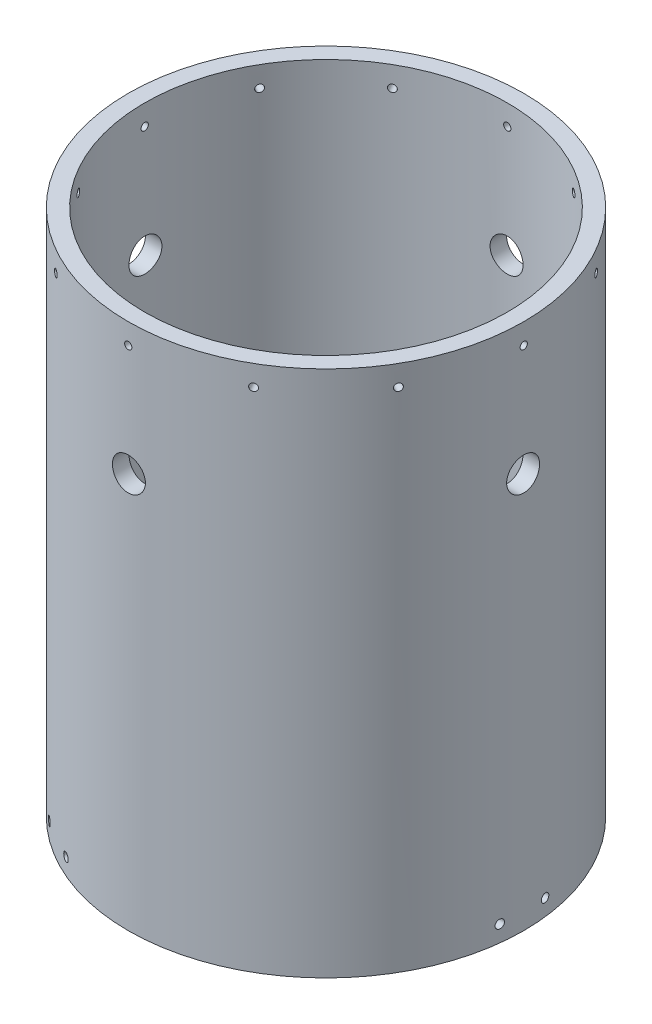
from build123d import *

# Parameters (mm, degrees)
SKETCH1_R                         = 152.4
SKETCH1_R_2                       = 139.7
BOSS_EXTRUDE1_DEPTH               = 406.4
F_10_CLEARANCE_HOLE1_REACH        = 532.368
F_10_CLEARANCE_HOLE1_BORE_R       = 2.8067
CIRPATTERN1_COUNT                 = 12
CUT_EXTRUDE1_REACH                = 532.368
CUT_EXTRUDE1_END_RADIUS           = 139.7
SKETCH4_R                         = 12.7
CIRPATTERN2_COUNT                 = 4
TAP_DRILL_FOR_5_16_18_TAP1_REACH  = 532.368
TAP_DRILL_FOR_5_16_18_TAP1_BORE_R = 3.2639
CIRPATTERN3_COUNT                 = 3


with BuildPart() as part:
    # Sketch1 → Boss-Extrude1 (new body)
    with BuildSketch(Plane(origin=(0, 0, 0), x_dir=(1, 0, 0), z_dir=(0, 1, 0))):
        with Locations(Location((0, 0, 0), (0, 0, 270))):
            Circle(SKETCH1_R)
        with Locations(Location((0, 0, 0), (0, 0, 270))):
            Circle(SKETCH1_R_2, mode=Mode.SUBTRACT)
    extrude(amount=BOSS_EXTRUDE1_DEPTH)

    # #10 Clearance Hole1 bore → #10 Clearance Hole1 (cut, up to next)
    with BuildSketch(Plane(origin=(152.4, 0, 0), x_dir=(0, 0, -1), z_dir=(1, 0, 0)), mode=Mode.PRIVATE) as f_10_clearance_hole1_sk1:
        with Locations((0, 390.525)):
            Circle(F_10_CLEARANCE_HOLE1_BORE_R)
    f_10_clearance_hole1_tool1 = extrude(f_10_clearance_hole1_sk1.sketch, amount=-F_10_CLEARANCE_HOLE1_REACH, mode=Mode.PRIVATE) & part.part
    f_10_clearance_hole1 = f_10_clearance_hole1_tool1.solids().sort_by_distance((152.4, 390.525, 0))[0]
    add(f_10_clearance_hole1, mode=Mode.SUBTRACT)

    # CirPattern1: #10 Clearance Hole1 ×12 about axis
    cirpattern1_axis = Axis((0, 406.4, 0), (0, 1, 0))
    for i in range(1, CIRPATTERN1_COUNT):
        add(f_10_clearance_hole1.rotate(cirpattern1_axis, i * 360 / CIRPATTERN1_COUNT), mode=Mode.SUBTRACT)

    # Cut-Extrude1: up to this cylinder (the profile starts outside it)
    cut_extrude1_end = Plane(origin=(0, 304.8, 0), z_dir=(0, -1, 0)) * Cylinder(CUT_EXTRUDE1_END_RADIUS, 1345.136, mode=Mode.PRIVATE)
    # Sketch4 → Cut-Extrude1 (cut, up to the surface)
    with BuildSketch(Plane(origin=(152.4, 0, 0), x_dir=(0, 0, -1), z_dir=(1, 0, 0)), mode=Mode.PRIVATE) as cut_extrude1_sk1:
        with Locations((0, 304.8)):
            Circle(SKETCH4_R)
    cut_extrude1_tool1 = extrude(cut_extrude1_sk1.sketch, amount=-CUT_EXTRUDE1_REACH, mode=Mode.PRIVATE) - cut_extrude1_end
    cut_extrude1 = cut_extrude1_tool1.solids().sort_by_distance((152.4, 304.8, 0))[0]
    add(cut_extrude1, mode=Mode.SUBTRACT)

    # CirPattern2: Cut-Extrude1 ×4 about axis
    cirpattern2_axis = Axis((0, 406.4, 0), (0, -1, 0))
    for i in range(1, CIRPATTERN2_COUNT):
        add(cut_extrude1.rotate(cirpattern2_axis, i * 360 / CIRPATTERN2_COUNT), mode=Mode.SUBTRACT)

    # Tap Drill for 5/16-18 Tap1 bore → Tap Drill for 5/16-18 Tap1 (cut, up to next)
    with BuildSketch(Plane(origin=(152.4, 0, 0), x_dir=(0, 0, -1), z_dir=(1, 0, 0)), mode=Mode.PRIVATE) as tap_drill_for_5_16_18_tap1_sk1:
        with Locations((17.4625, 12.7)):
            Circle(TAP_DRILL_FOR_5_16_18_TAP1_BORE_R)
    tap_drill_for_5_16_18_tap1_tool1 = extrude(tap_drill_for_5_16_18_tap1_sk1.sketch, amount=-TAP_DRILL_FOR_5_16_18_TAP1_REACH, mode=Mode.PRIVATE) & part.part
    # Tap Drill for 5/16-18 Tap1 bore → Tap Drill for 5/16-18 Tap1 (cut, up to next)
    with BuildSketch(Plane(origin=(152.4, 0, 0), x_dir=(0, 0, -1), z_dir=(1, 0, 0)), mode=Mode.PRIVATE) as tap_drill_for_5_16_18_tap1_sk2:
        with Locations((-17.4625, 12.7)):
            Circle(TAP_DRILL_FOR_5_16_18_TAP1_BORE_R)
    tap_drill_for_5_16_18_tap1_tool2 = extrude(tap_drill_for_5_16_18_tap1_sk2.sketch, amount=-TAP_DRILL_FOR_5_16_18_TAP1_REACH, mode=Mode.PRIVATE) & part.part
    tap_drill_for_5_16_18_tap1_1 = tap_drill_for_5_16_18_tap1_tool1.solids().sort_by_distance((152.4, 12.7, -17.4625))[0]
    add(tap_drill_for_5_16_18_tap1_1, mode=Mode.SUBTRACT)
    tap_drill_for_5_16_18_tap1_2 = tap_drill_for_5_16_18_tap1_tool2.solids().sort_by_distance((152.4, 12.7, 17.4625))[0]
    add(tap_drill_for_5_16_18_tap1_2, mode=Mode.SUBTRACT)
    tap_drill_for_5_16_18_tap1 = tap_drill_for_5_16_18_tap1_1 + tap_drill_for_5_16_18_tap1_2  # Tap Drill for 5/16-18 Tap1 as one shape, for the pattern or mirror that repeats it

    # CirPattern3: Tap Drill for 5/16-18 Tap1 ×3 about axis
    cirpattern3_axis = Axis((0, 406.4, 0), (0, -1, 0))
    for i in range(1, CIRPATTERN3_COUNT):
        add(tap_drill_for_5_16_18_tap1.rotate(cirpattern3_axis, i * 360 / CIRPATTERN3_COUNT), mode=Mode.SUBTRACT)


solid = part.part
